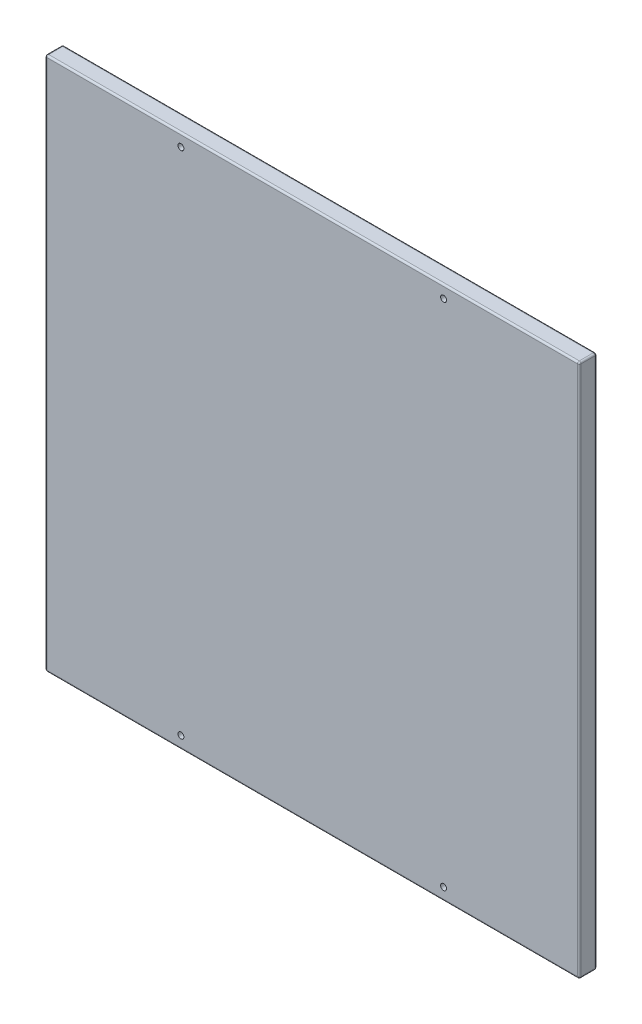
from build123d import *

# Parameters (mm, degrees)
SKETCH1_W            = 305
SKETCH1_H            = 305
CAST_ALUMINIUM_DEPTH = 10
CORNER_FILLETS_R     = 1
SKETCH2_R            = 1.7
MOUNTING_HOLES_DEPTH = 216.899282074


with BuildPart() as part:
    # Sketch1 → cast aluminium (new body)
    with BuildSketch(Plane.XY):
        Rectangle(SKETCH1_W, SKETCH1_H)
    extrude(amount=CAST_ALUMINIUM_DEPTH)

    # corner fillets
    corner_fillets_edges = [part.edges().sort_by_distance(p)[0] for p in [
        (-152.5, 0, 10),
        (0, -152.5, 10),
        (152.5, 0, 10),
        (0, -152.5, 0),
        (-152.5, 0, 0),
        (0, 152.5, 0),
        (152.5, 0, 0),
        (152.5, -152.5, 5),
        (-152.5, -152.5, 5),
        (-152.5, 152.5, 5),
        (152.5, 152.5, 5),
        (0, 152.5, 10),
    ]]
    fillet(corner_fillets_edges, radius=CORNER_FILLETS_R)

    # Sketch2 → mounting holes (cut, through all)
    with BuildSketch(Plane.XY.offset(10)):
        with Locations((-75, 145.5)):
            Circle(SKETCH2_R)
        with Locations((75, 145.5)):
            Circle(SKETCH2_R)
        with Locations((75, -145.5)):
            Circle(SKETCH2_R)
        with Locations((-75, -145.5)):
            Circle(SKETCH2_R)
    extrude(amount=-MOUNTING_HOLES_DEPTH, mode=Mode.SUBTRACT)


solid = part.part
